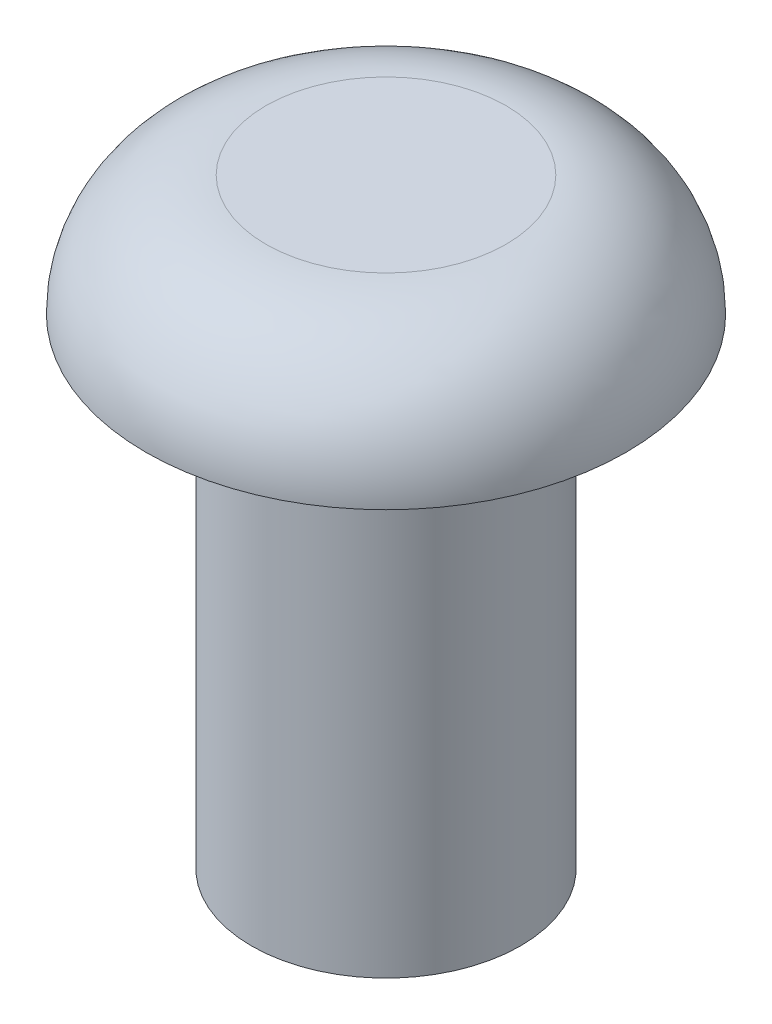
from build123d import *


with BuildPart() as part:
    # Sketch1 → Revolve1 (revolve)
    with BuildSketch(Plane(origin=(0, 0, 0), x_dir=(0, 0, -1), z_dir=(1, 0, 0))):
        with BuildLine():
            Line((0, 0), (1.778, 0))
            Line((1.778, 0), (1.778, 6.35))
            Line((1.778, 6.35), (3.175, 6.35))
            ThreePointArc((3.175, 6.35), (2.710032015, 7.472532015), (1.5875, 7.9375))
            Line((1.5875, 7.9375), (0, 7.9375))
            Line((0, 7.9375), (0, 0))
        make_face()
    revolve(axis=Axis((0, 0, 0), (0, 1, 0)))


solid = part.part
